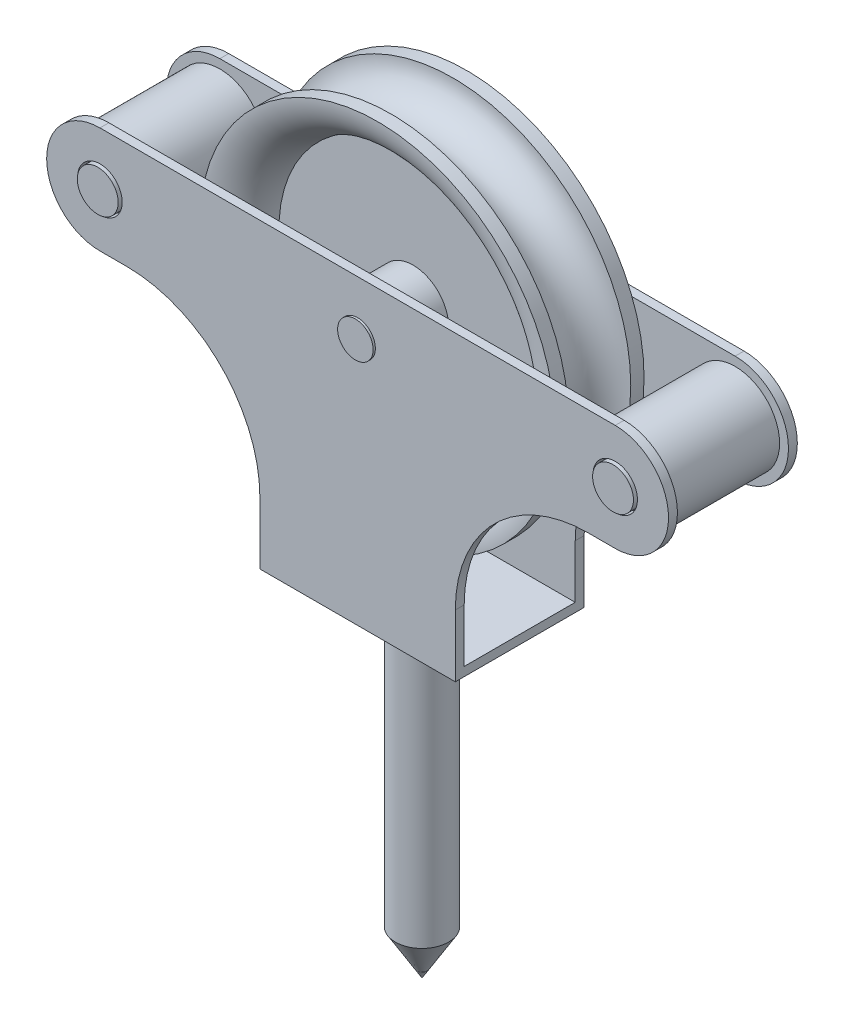
from build123d import *

# Parameters (mm, degrees)
SKETCH3_R           = 2.5
BOSS_EXTRUDE1_DEPTH = 7.25
CUT_EXTRUDE3_DEPTH  = 40
SKETCH5_R           = 3
BOSS_EXTRUDE2_DEPTH = 38
CHAMFER1_SIZE       = 5
CHAMFER1_SIZE2      = 3
CIRPATTERN3_COUNT   = 2


with BuildPart() as part:
    # Sketch1 → Revolve1 (revolve)
    with BuildSketch(Plane(origin=(0, 0, 0), x_dir=(0, 0, -1), z_dir=(1, 0, 0)), mode=Mode.PRIVATE) as revolve1_sk:
        with BuildLine():
            Line((-7.5, 0), (-7.5, 2))
            Line((-7.5, 2), (-5, 2))
            Line((-5, 2), (-5, 4))
            Line((-5, 4), (-1, 4))
            Line((-1, 4), (-1, 15.101020514))
            ThreePointArc((-1, 15.101020514), (-3.872983346, 16.83772234), (-5, 20))
            Line((-5, 20), (-3.5, 20))
            ThreePointArc((-3.5, 20), (0, 16.5), (3.5, 20))
            Line((3.5, 20), (5, 20))
            ThreePointArc((5, 20), (3.872983346, 16.83772234), (1, 15.101020514))
            Line((1, 15.101020514), (1, 4))
            Line((1, 4), (5, 4))
            Line((5, 4), (5, 2))
            Line((5, 2), (7.5, 2))
            Line((7.5, 2), (7.5, 0))
            Line((7.5, 0), (-7.5, 0))
        make_face()
    revolve(revolve1_sk.sketch.rotate(Axis((0, 0, 12.486294241), (0, 0, -1)), 90), axis=Axis((0, 0, 12.486294241), (0, 0, -1)))


with BuildPart() as body_2:
    # Sketch3 → Boss-Extrude1 (new, symmetric)
    with BuildSketch(Plane.XY):
        with BuildLine():
            Line((-29.003340958, 6), (29.003340958, 6))
            ThreePointArc((29.003340958, 6), (35.003340958, 0), (29.003340958, -6))
            Line((29.003340958, -6), (26, -6))
            ThreePointArc((26, -6), (15.393398282, -10.393398282), (11, -21))
            Line((11, -21), (11, -28))
            Line((11, -28), (-11, -28))
            Line((-11, -28), (-11, -21))
            ThreePointArc((-11, -21), (-15.393398282, -10.393398282), (-26, -6))
            Line((-26, -6), (-29.003340958, -6))
            ThreePointArc((-29.003340958, -6), (-35.003340958, 0), (-29.003340958, 6))
        make_face()
        with Locations(Location((-29.003340958, 0, 0), (0, 0, 180))):
            Circle(SKETCH3_R, mode=Mode.SUBTRACT)
        with Locations(Location((29.003340958, 0, 0), (0, 0, 180))):
            Circle(SKETCH3_R, mode=Mode.SUBTRACT)
    extrude(amount=BOSS_EXTRUDE1_DEPTH, both=True)

    # Sketch4 → Cut-Extrude3 (cut, symmetric)
    with BuildSketch(Plane(origin=(0, 0, 0), x_dir=(0, 0, -1), z_dir=(1, 0, 0))):
        Polygon((-6.25, 6), (6.25, 6), (6.25, -6), (6.25, -21), (6.25, -27), (-6.25, -27), (-6.25, -21), (-6.25, -6), align=None)
    extrude(amount=CUT_EXTRUDE3_DEPTH, both=True, mode=Mode.SUBTRACT)

    # Sketch5 → Boss-Extrude2 (add)
    with BuildSketch(Plane.XZ.offset(28)):
        with Locations(Location((0, 0, 0), (0, 0, 90))):
            Circle(SKETCH5_R)
    extrude(amount=BOSS_EXTRUDE2_DEPTH)

    # Chamfer1
    chamfer1_edges = [body_2.edges().sort_by_distance(p)[0] for p in [
        (0, -66, -3),
    ]]
    chamfer1_side = [body_2.faces().sort_by_distance(p)[0] for p in [
        (0, -47, -3),
    ]]
    chamfer(chamfer1_edges, length=CHAMFER1_SIZE, length2=CHAMFER1_SIZE2, reference=chamfer1_side[0])


with BuildPart() as body_3:
    # Sketch6 → Revolve6 (revolve)
    with BuildSketch(Plane(origin=(0, 0, 0), x_dir=(1, 0, 0), z_dir=(0, 1, 0))):
        Polygon((-29.003340958, 7.5), (-29.003340958, -7.5), (-31.303340958, -7.5), (-31.303340958, -6.25), (-34.003340958, -6.25), (-34.003340958, 6.25), (-31.303340958, 6.25), (-31.303340958, 7.5), align=None)
    revolve(axis=Axis((-29.003340958, 0, -10.015423598), (0, 0, 1)))


with BuildPart() as cirpattern3_1:
    # CirPattern3: pattern copy
    add(body_3.part.rotate(Axis((0, 0, 0), (0, 0, 1)), 1 * 360 / CIRPATTERN3_COUNT))


solid = Compound([part.part, body_2.part, body_3.part, cirpattern3_1.part])
